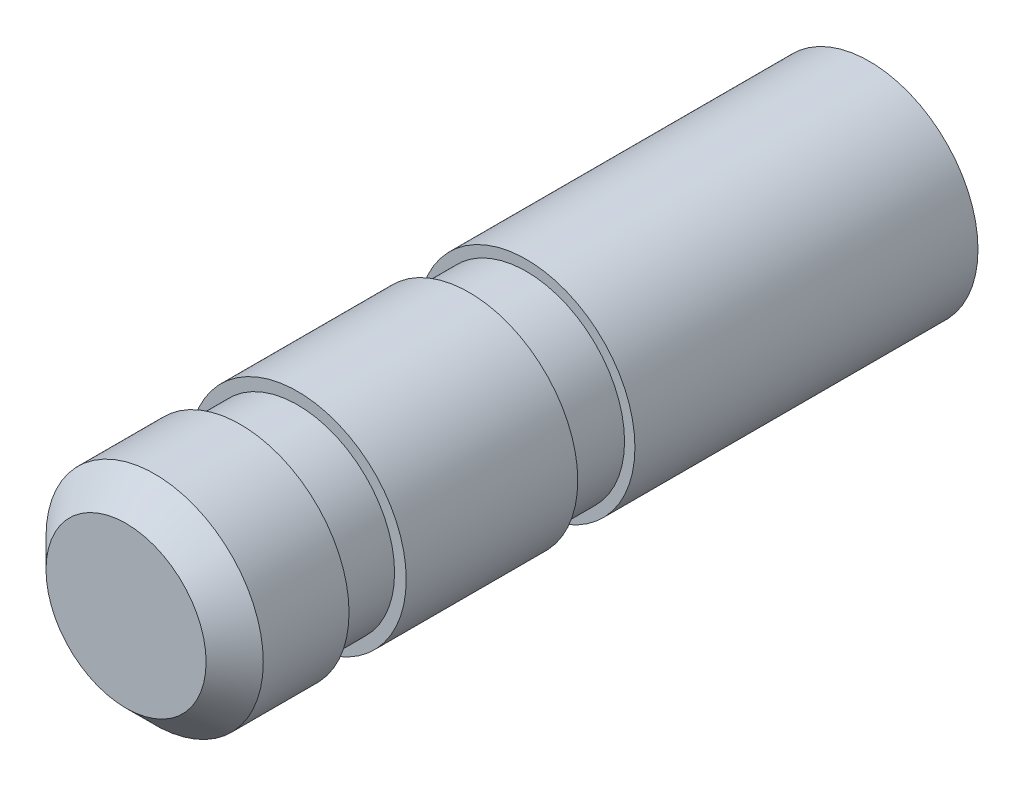
from build123d import *

# Parameters (mm, degrees)
SKETCH1_R           = 1.9
BOSS_EXTRUDE1_DEPTH = 13
CHAMFER1_SIZE       = 0.5
SKETCH4_W           = 1
SKETCH4_H           = 0.407466182
SKETCH7_W           = 1
SKETCH7_H           = 0.36313202


with BuildPart() as part:
    # Sketch1 → Boss-Extrude1 (new body)
    with BuildSketch(Plane.XY):
        with Locations(Location((0, 0, 0), (0, 0, 180))):
            Circle(SKETCH1_R)
    extrude(amount=BOSS_EXTRUDE1_DEPTH)

    # Chamfer1
    chamfer1_edges = [part.edges().sort_by_distance(p)[0] for p in [
        (1.9, 0, 13),
    ]]
    chamfer(chamfer1_edges, length=CHAMFER1_SIZE)

    # Sketch4 → Cut-Revolve4 (revolve, cut)
    with BuildSketch(Plane(origin=(0, 0, 0), x_dir=(0, 0, -1), z_dir=(1, 0, 0)), mode=Mode.PRIVATE) as cut_revolve4_sk:
        with Locations((-10.5, 1.9)):
            Rectangle(SKETCH4_W, SKETCH4_H)
    revolve(cut_revolve4_sk.sketch.rotate(Axis((0, 0, 14.953462275), (0, 0, -1)), 270), axis=Axis((0, 0, 14.953462275), (0, 0, -1)), mode=Mode.SUBTRACT)

    # Sketch7 → Cut-Revolve7 (revolve, cut)
    with BuildSketch(Plane(origin=(0, 0, 0), x_dir=(0, 0, -1), z_dir=(1, 0, 0)), mode=Mode.PRIVATE) as cut_revolve7_sk:
        with Locations((-6.5, 1.9)):
            Rectangle(SKETCH7_W, SKETCH7_H)
    revolve(cut_revolve7_sk.sketch.rotate(Axis((0, 0, 14.336983713), (0, 0, -1)), 270), axis=Axis((0, 0, 14.336983713), (0, 0, -1)), mode=Mode.SUBTRACT)


solid = part.part
